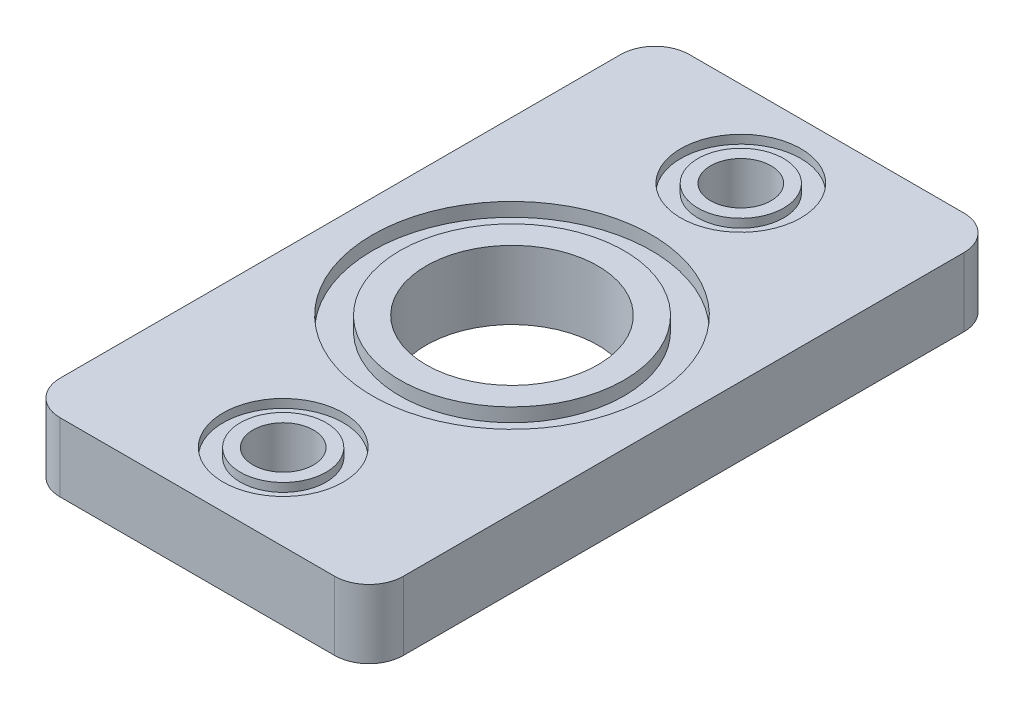
from build123d import *

# Parameters (mm, degrees)
ESQUISSE1_W                     = 30
ESQUISSE1_H                     = 55
PLAQUE_PLEXI_DEPTH              = 6
PASSAGE_JAUGE_LAITON_REACH      = 33.894
ESQUISSE5_R                     = 7.5
PASSAGE_CROU_M5_REACH           = 33.894
ESQUISSE6_R                     = 2.65
ESQUISSE2_R                     = 12.2
ESQUISSE2_R_2                   = 9.8
GORGE_JOINT_CENTRAL_DEPTH       = 1.2
ESQUISSE7_R                     = 5.25
ESQUISSE7_R_2                   = 3.75
ENL_V_DE_MAT_EXTRU_MINCE2_DEPTH = 0.75
CONG_1_R                        = 3


with BuildPart() as part:
    # Esquisse1 → Plaque Plexi (new body)
    with BuildSketch(Plane(origin=(0, 0, 0), x_dir=(1, 0, 0), z_dir=(0, 1, 0))):
        Rectangle(ESQUISSE1_W, ESQUISSE1_H)
    extrude(amount=PLAQUE_PLEXI_DEPTH)

    # Esquisse5 → Passage Jauge Laiton (cut, up to next)
    with BuildSketch(Plane(origin=(0, 6, 0), x_dir=(1, 0, 0), z_dir=(0, 1, 0)), mode=Mode.PRIVATE) as passage_jauge_laiton_sk1:
        with Locations(Location((0, 0, 0), (0, 0, 270))):
            Circle(ESQUISSE5_R)
    passage_jauge_laiton_tool1 = extrude(passage_jauge_laiton_sk1.sketch, amount=-PASSAGE_JAUGE_LAITON_REACH, mode=Mode.PRIVATE) & part.part
    add(passage_jauge_laiton_tool1.solids().sort_by_distance((0, 6, 0))[0], mode=Mode.SUBTRACT)

    # Esquisse6 → Passage écrou M5 (cut, up to next)
    with BuildSketch(Plane(origin=(0, 6, 0), x_dir=(1, 0, 0), z_dir=(0, 1, 0)), mode=Mode.PRIVATE) as passage_crou_m5_sk1:
        with Locations(Location((0, 20, 0), (0, 0, 270))):
            Circle(ESQUISSE6_R)
    passage_crou_m5_tool1 = extrude(passage_crou_m5_sk1.sketch, amount=-PASSAGE_CROU_M5_REACH, mode=Mode.PRIVATE) & part.part
    # Esquisse6 → Passage écrou M5 (cut, up to next)
    with BuildSketch(Plane(origin=(0, 6, 0), x_dir=(1, 0, 0), z_dir=(0, 1, 0)), mode=Mode.PRIVATE) as passage_crou_m5_sk2:
        with Locations(Location((0, -20, 0), (0, 0, 270))):
            Circle(ESQUISSE6_R)
    passage_crou_m5_tool2 = extrude(passage_crou_m5_sk2.sketch, amount=-PASSAGE_CROU_M5_REACH, mode=Mode.PRIVATE) & part.part
    add(passage_crou_m5_tool1.solids().sort_by_distance((0, 6, -20))[0], mode=Mode.SUBTRACT)
    add(passage_crou_m5_tool2.solids().sort_by_distance((0, 6, 20))[0], mode=Mode.SUBTRACT)

    # Esquisse2 → Gorge_Joint_central (cut)
    with BuildSketch(Plane(origin=(0, 6, 0), x_dir=(1, 0, 0), z_dir=(0, 1, 0))):
        Circle(ESQUISSE2_R)
        Circle(ESQUISSE2_R_2, mode=Mode.SUBTRACT)
    extrude(amount=-GORGE_JOINT_CENTRAL_DEPTH, mode=Mode.SUBTRACT)

    # Esquisse7 → Enlèv. de mat.-Extru.-Mince2 (cut)
    # profile 1 of 2: a face of its own
    with BuildSketch(Plane(origin=(0, 6, 0), x_dir=(1, 0, 0), z_dir=(0, 1, 0))):
        with Locations((0, -20)):
            Circle(ESQUISSE7_R)
        with Locations((0, -20)):
            Circle(ESQUISSE7_R_2, mode=Mode.SUBTRACT)
    # profile 2 of 2: a face of its own
    with BuildSketch(Plane(origin=(0, 6, 0), x_dir=(1, 0, 0), z_dir=(0, 1, 0))):
        with Locations((0, 20)):
            Circle(ESQUISSE7_R)
        with Locations((0, 20)):
            Circle(ESQUISSE7_R_2, mode=Mode.SUBTRACT)
    extrude(amount=-ENL_V_DE_MAT_EXTRU_MINCE2_DEPTH, mode=Mode.SUBTRACT)

    # Congé1
    cong_1_edges = [part.edges().sort_by_distance(p)[0] for p in [
        (-15, 3, -27.5),
        (15, 3, -27.5),
        (15, 3, 27.5),
        (-15, 3, 27.5),
    ]]
    fillet(cong_1_edges, radius=CONG_1_R)


solid = part.part
